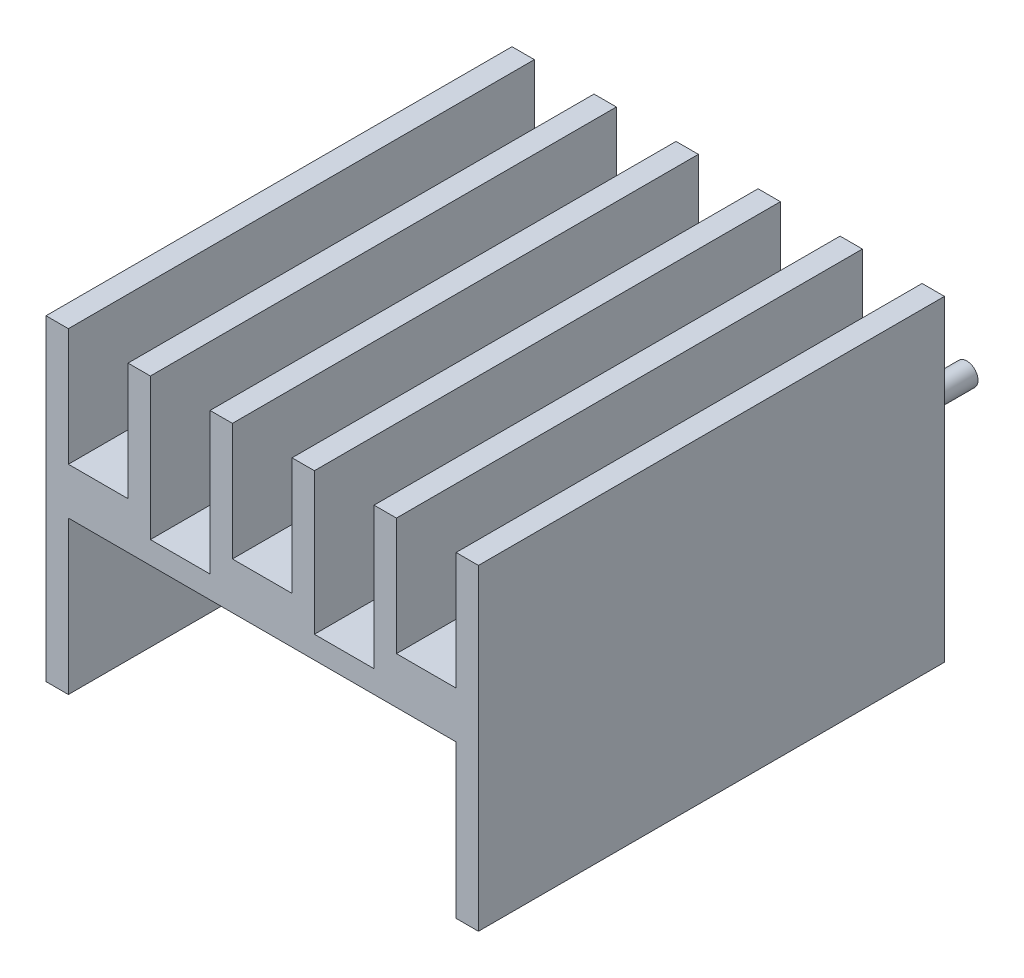
from build123d import *

# Parameters (mm, degrees)
EXTRUDE_1_DEPTH = 25
SKETCH_2_R      = 0.6
EXTRUDE_2_DEPTH = 4


with BuildPart() as part:
    # 草图1 → 凸台-拉伸1 (new body)
    with BuildSketch(Plane.XY):
        Polygon((-11.6, 8.8), (-11.6, -8.2), (-10.4, -8.2), (-10.4, 0), (10.4, 0), (10.4, -8.2), (11.6, -8.2), (11.6, 8.8), (10.4, 8.8), (10.4, 2.5), (7.2, 2.5), (7.2, 8.8), (6, 8.8), (6, 1.2), (2.8, 1.2), (2.8, 8.8), (1.6, 8.8), (1.6, 2.5), (-1.6, 2.5), (-1.6, 8.8), (-2.8, 8.8), (-2.8, 1.2), (-6, 1.2), (-6, 8.8), (-7.2, 8.8), (-7.2, 2.5), (-10.4, 2.5), (-10.4, 8.8), align=None)
    extrude(amount=EXTRUDE_1_DEPTH)

    # 草图2 → 凸台-拉伸2 (add)
    with BuildSketch(Plane(origin=(0, 0, 0), x_dir=(-1, 0, 0), z_dir=(0, 0, -1))):
        with Locations(Location((-8.8, 1.8, 0), (0, 0, 180))):
            Circle(SKETCH_2_R)
        with Locations(Location((8.8, 1.8, 0), (0, 0, 180))):
            Circle(SKETCH_2_R)
    extrude(amount=EXTRUDE_2_DEPTH)


solid = part.part
